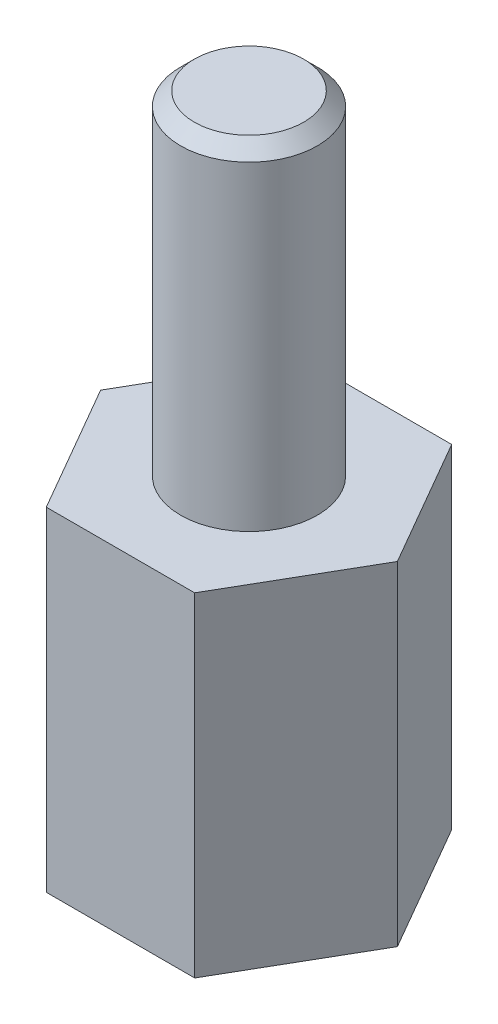
from build123d import *

# Parameters (mm, degrees)
BOSS_EXTRUDE1_DEPTH = 6.1
SKETCH2_R           = 1.25
BOSS_EXTRUDE2_DEPTH = 6.1
CHAMFER1_SIZE       = 0.25
SKETCH3_R           = 1.25
CUT_EXTRUDE1_DEPTH  = 5.5


with BuildPart() as part:
    # Sketch1 → Boss-Extrude1 (new body)
    with BuildSketch(Plane(origin=(0, 0, 0), x_dir=(1, 0, 0), z_dir=(0, 1, 0))):
        Polygon((2.713546265, 0), (1.356773133, 2.35), (-1.356773133, 2.35), (-2.713546265, 0), (-1.356773133, -2.35), (1.356773133, -2.35), align=None)
    extrude(amount=BOSS_EXTRUDE1_DEPTH)

    # Sketch2 → Boss-Extrude2 (add)
    with BuildSketch(Plane(origin=(0, 6.1, 0), x_dir=(1, 0, 0), z_dir=(0, 1, 0))):
        with Locations(Location((0, 0, 0), (0, 0, 270))):
            Circle(SKETCH2_R)
    extrude(amount=BOSS_EXTRUDE2_DEPTH)

    # Chamfer1
    chamfer1_edges = [part.edges().sort_by_distance(p)[0] for p in [
        (0, 12.2, -1.25),
    ]]
    chamfer(chamfer1_edges, length=CHAMFER1_SIZE)

    # Sketch3 → Cut-Extrude1 (cut)
    with BuildSketch(Plane.XZ):
        with Locations(Location((0, 0, 0), (0, 0, 90))):
            Circle(SKETCH3_R)
    extrude(amount=-CUT_EXTRUDE1_DEPTH, mode=Mode.SUBTRACT)


solid = part.part
